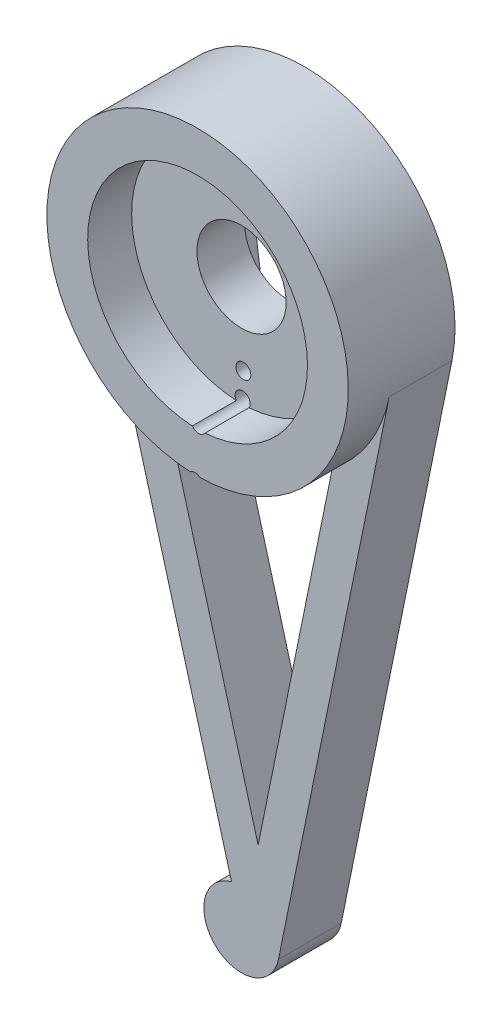
from build123d import *

# Parameters (mm, degrees)
SKETCH1_R               = 3.55
BOSS_EXTRUDE1_DEPTH     = 5
CUT_EXTRUDE1_DEPTH      = 1.2
SKETCH3_R               = 8.75
BOSS_EXTRUDE2_DEPTH     = 3.5
CUT_EXTRUDE2_DEPTH      = 51.012898336
CUT_EXTRUDE2_DEPTH_BACK = 51.012898336
SKETCH5_R               = 0.6


with BuildPart() as part:
    # Sketch1 → Boss-Extrude1 (new body)
    with BuildSketch(Plane.XY):
        with BuildLine():
            Line((2.939387691, -45.6), (11.757550765, -2.4))
            ThreePointArc((11.757550765, -2.4), (-0.411368636, 11.992946921), (-11.565465836, -3.2))
            Line((-11.565465836, -3.2), (-0.8, -42.108633541))
            ThreePointArc((-0.8, -42.108633541), (-2.047353135, -47.192793912), (2.939387691, -45.6))
        make_face()
        Circle(SKETCH1_R, mode=Mode.SUBTRACT)
        with BuildLine():
            Line((1.321479166, -38.526100673), (7.223456236, -9.612436083))
            ThreePointArc((7.223456236, -9.612436083), (0.272467701, -12.215673533), (-6.678520834, -9.612436083))
            Line((-6.678520834, -9.612436083), (1.321479166, -38.526100673))
        make_face(mode=Mode.SUBTRACT)
    extrude(amount=BOSS_EXTRUDE1_DEPTH)

    # Sketch2 → Cut-Extrude1 (cut)
    with BuildSketch(Plane(origin=(0, 0, 0), x_dir=(-1, 0, 0), z_dir=(0, 0, -1))):
        with BuildLine():
            Line((-1.9821425, -15.266666667), (-3.964284999, -0.533333333))
            ThreePointArc((-3.964284999, -0.533333333), (0, 4), (3.964284999, -0.533333333))
            Line((3.964284999, -0.533333333), (1.9821425, -15.266666667))
            ThreePointArc((1.9821425, -15.266666667), (0, -17), (-1.9821425, -15.266666667))
        make_face()
    extrude(amount=-CUT_EXTRUDE1_DEPTH, mode=Mode.SUBTRACT)

    # Sketch3 → Boss-Extrude2 (add)
    with BuildSketch(Plane.XY.offset(5)):
        with BuildLine():
            ThreePointArc((11.757550765, -2.4), (-0.411368636, 11.992946921), (-11.565465836, -3.2))
            ThreePointArc((-11.565465836, -3.2), (0.411368636, -11.992946921), (11.757550765, -2.4))
        make_face()
        Circle(SKETCH3_R, mode=Mode.SUBTRACT)
    extrude(amount=BOSS_EXTRUDE2_DEPTH)

    # Sketch5 → Cut-Extrude2 (cut, two sides: drawn at the far end of the back side and taken through both)
    with BuildSketch(Plane(origin=(0, 0, 1.2), x_dir=(-1, 0, 0), z_dir=(0, 0, -1)).offset(-CUT_EXTRUDE2_DEPTH_BACK)):
        with Locations((-0.141802358, -6.414025874)):
            Circle(SKETCH5_R)
        with Locations((-0.086177178, -8.414025874)):
            Circle(SKETCH5_R)
        with Locations((0.232439079, -14.448130401)):
            Circle(SKETCH5_R)
        with Locations((0.20026758, -12.448389169)):
            Circle(SKETCH5_R)
    extrude(amount=CUT_EXTRUDE2_DEPTH + CUT_EXTRUDE2_DEPTH_BACK, mode=Mode.SUBTRACT)


solid = part.part
